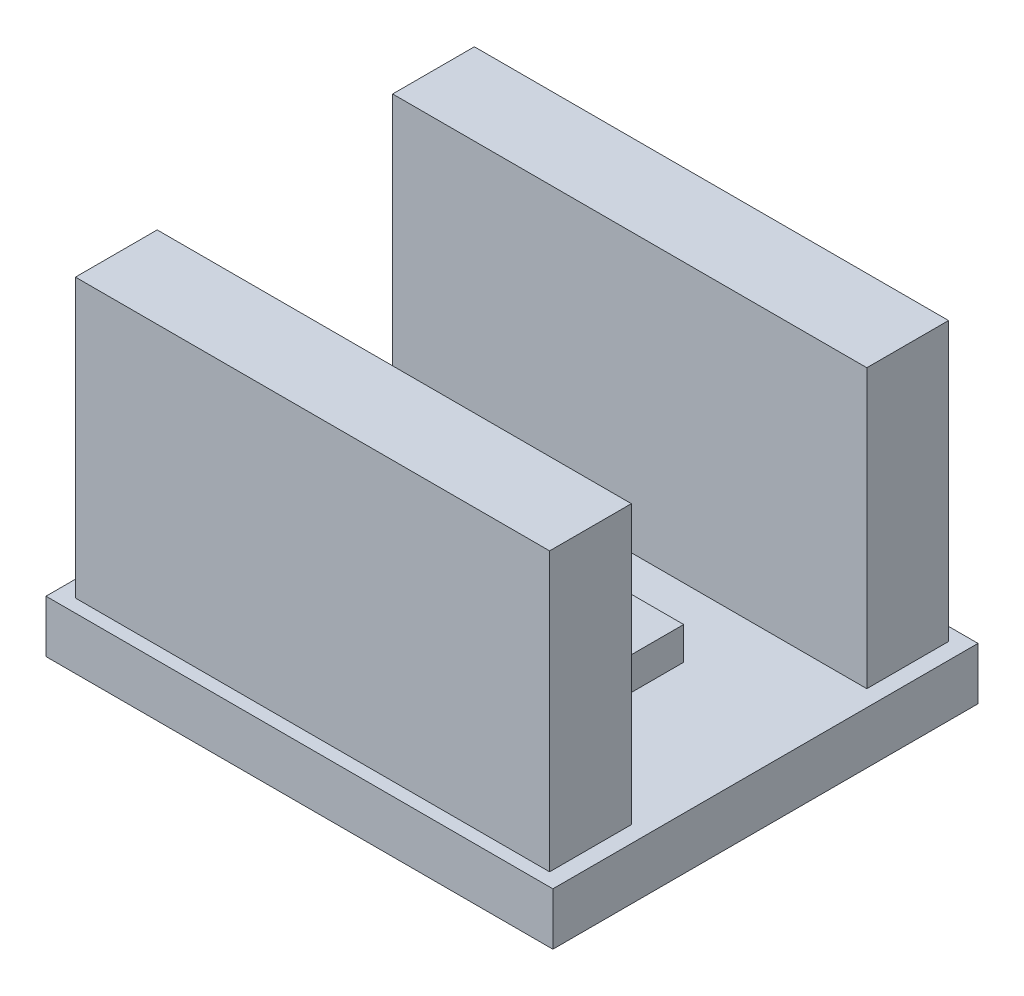
from build123d import *

# Parameters (mm, degrees)
SKETCH1_W       = 15.5
SKETCH1_H       = 13
PCB_DEPTH       = 1.6
HEADER_HV_START = 1.6
SKETCH2_W       = 14.5
SKETCH2_H       = 2.5
HEADER_HV_DEPTH = 8.5
HEADER_LV_START = 1.6
SKETCH3_W       = 14.5
SKETCH3_H       = 2.5
HEADER_LV_DEPTH = 8.5
MOSFETS_START   = 1.6
SKETCH4_W       = 7.5
SKETCH4_H       = 3
MOSFETS_DEPTH   = 1


with BuildPart() as part:
    # Sketch1 → PCB (new body)
    with BuildSketch(Plane(origin=(0, 0, 0), x_dir=(1, 0, 0), z_dir=(0, 1, 0))):
        with Locations((7.75, 6.5)):
            Rectangle(SKETCH1_W, SKETCH1_H)
    extrude(amount=PCB_DEPTH)

    # Sketch2 → Header_HV (add)
    with BuildSketch(Plane(origin=(0, 0, 0), x_dir=(1, 0, 0), z_dir=(0, 1, 0)).offset(HEADER_HV_START)):
        with Locations((7.75, 1.65)):
            Rectangle(SKETCH2_W, SKETCH2_H)
    extrude(amount=HEADER_HV_DEPTH)

    # Sketch3 → Header_LV (add)
    with BuildSketch(Plane(origin=(0, 0, 0), x_dir=(1, 0, 0), z_dir=(0, 1, 0)).offset(HEADER_LV_START)):
        with Locations((7.75, 11.35)):
            Rectangle(SKETCH3_W, SKETCH3_H)
    extrude(amount=HEADER_LV_DEPTH)

    # Sketch4 → MOSFETs (add)
    with BuildSketch(Plane(origin=(0, 0, 0), x_dir=(1, 0, 0), z_dir=(0, 1, 0)).offset(MOSFETS_START)):
        with Locations((7.75, 6.5)):
            Rectangle(SKETCH4_W, SKETCH4_H)
    extrude(amount=MOSFETS_DEPTH)


solid = part.part
